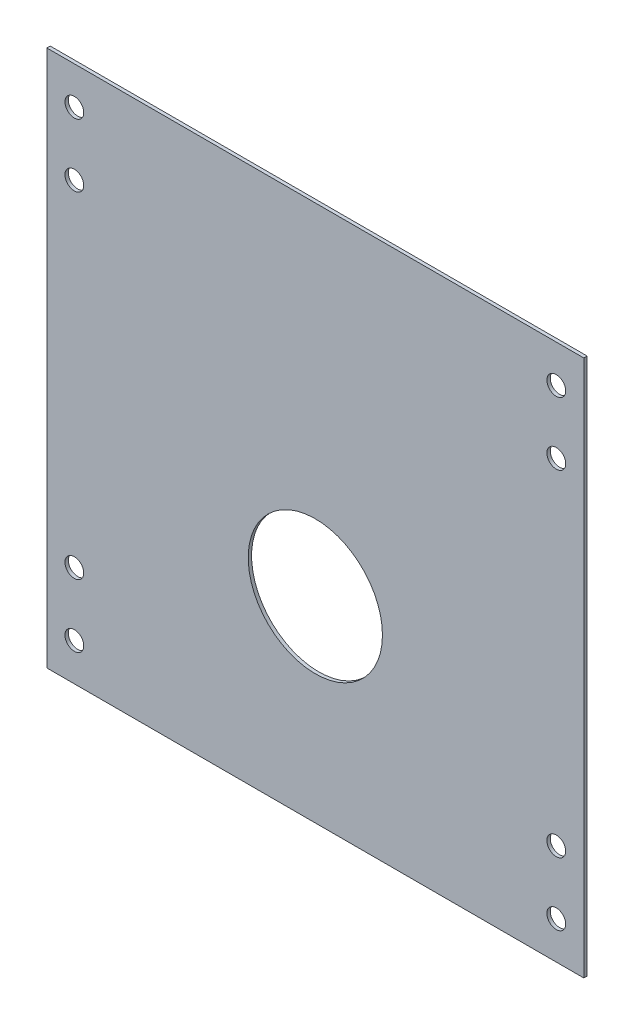
from build123d import *

# Parameters (mm, degrees)
SKETCH_2_W          = 406.4
SKETCH_2_H          = 406.4
SKETCH_2_R          = 50.8
EXTRUDE_1_DEPTH     = 2.54
SKETCH_4_R          = 7.112
CUT_EXTRUDE_4_DEPTH = 288.379420975


with BuildPart() as part:
    # 草图2 → 凸台-拉伸1 (new body)
    with BuildSketch(Plane.XY):
        Rectangle(SKETCH_2_W, SKETCH_2_H)
        with Locations((0, -54.602000016)):
            Circle(SKETCH_2_R, mode=Mode.SUBTRACT)
    extrude(amount=EXTRUDE_1_DEPTH)

    # 草图4 → 切除-拉伸4 (cut, through all)
    with BuildSketch(Plane.XY):
        with Locations((-182.372, 127)):
            Circle(SKETCH_4_R)
        with Locations((-182.372, 174.752)):
            Circle(SKETCH_4_R)
        with Locations(Location((-182.372, -174.752, 0), (0, 0, 180))):
            Circle(SKETCH_4_R)
        with Locations(Location((-182.372, -127, 0), (0, 0, 180))):
            Circle(SKETCH_4_R)
        with Locations((182.372, -127)):
            Circle(SKETCH_4_R)
        with Locations((182.372, -174.752)):
            Circle(SKETCH_4_R)
        with Locations(Location((182.372, 174.752, 0), (0, 0, 180))):
            Circle(SKETCH_4_R)
        with Locations(Location((182.372, 127, 0), (0, 0, 180))):
            Circle(SKETCH_4_R)
    extrude(amount=CUT_EXTRUDE_4_DEPTH, mode=Mode.SUBTRACT)


solid = part.part
